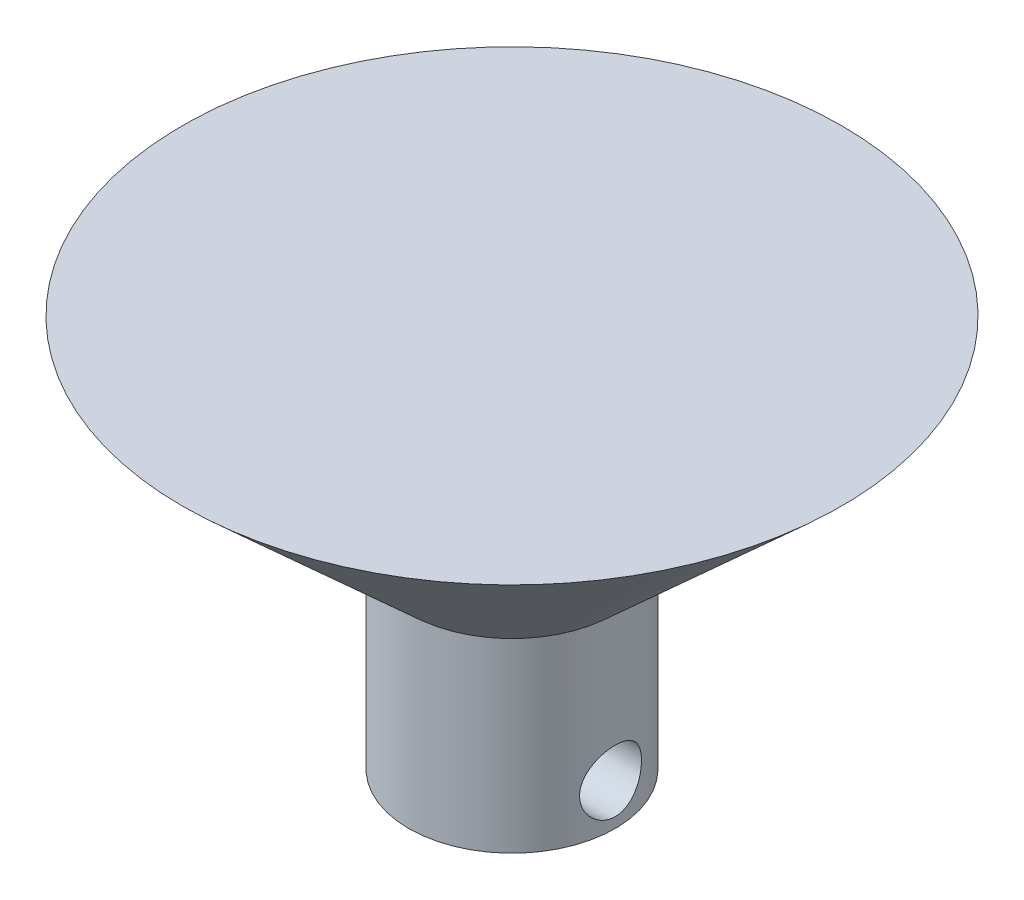
from build123d import *

# Parameters (mm, degrees)
SKETCH1_R             = 5
BODY_DEPTH            = 9
PIN_INSERT_DEPTH      = 12.445523142
PIN_INSERT_DEPTH_BACK = 12.445523142
SKETCH2_R             = 1.5
HEAD_SA_R             = 15.958


with BuildPart() as part:
    # Sketch1 → body (new body)
    with BuildSketch(Plane(origin=(0, 0, 0), x_dir=(1, 0, 0), z_dir=(0, 1, 0))):
        with Locations(Location((0, 0, 0), (0, 0, 270))):
            Circle(SKETCH1_R)
    extrude(amount=BODY_DEPTH)

    # Sketch2 → pin insert (cut, two sides: drawn at the far end of the back side and taken through both)
    with BuildSketch(Plane(origin=(0, 0, 0), x_dir=(0, 0, -1), z_dir=(1, 0, 0)).offset(-PIN_INSERT_DEPTH_BACK)):
        with Locations((0, 2)):
            Circle(SKETCH2_R)
    extrude(amount=PIN_INSERT_DEPTH + PIN_INSERT_DEPTH_BACK, mode=Mode.SUBTRACT)

    # head SA → section 0 of cone
    with BuildSketch(Plane(origin=(0, 19, 0), x_dir=(1, 0, 0), z_dir=(0, 1, 0)), mode=Mode.PRIVATE) as cone_s0:
        Circle(HEAD_SA_R)
    # loft up to a face of the part (cone)
    loft([cone_s0.sketch, part.faces().sort_by_distance((0, 9, 0))[0]])


solid = part.part
